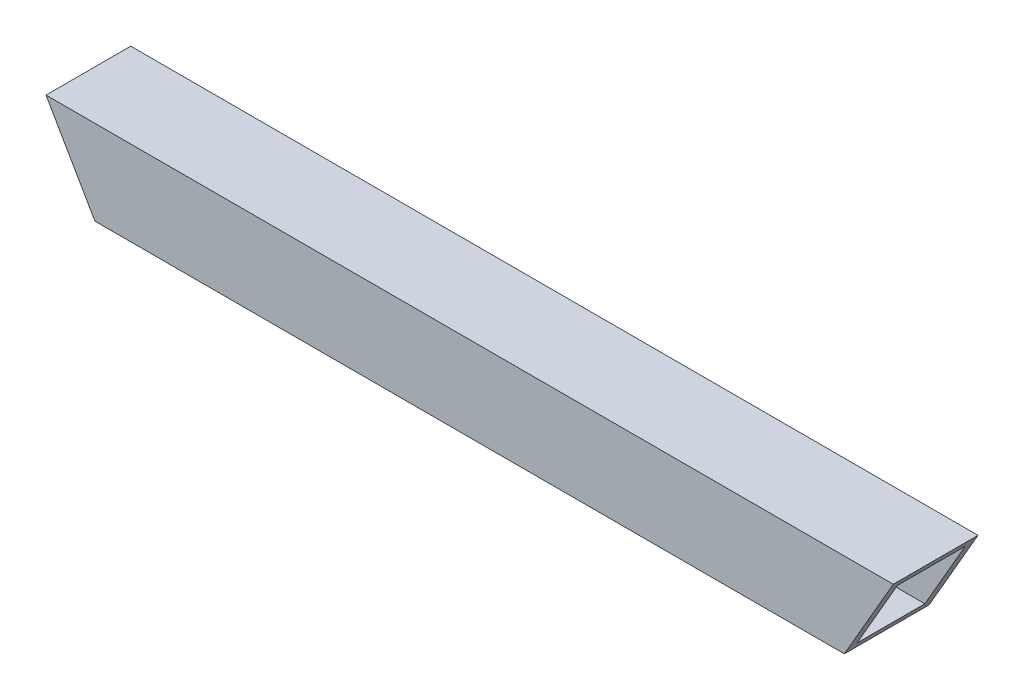
from build123d import *

# Parameters (mm, degrees)
BOSS_EXTRUDE1_DEPTH = 50
SKETCH4_W           = 40
SKETCH4_H           = 47.735026919
CUT_EXTRUDE1_DEPTH  = 584.249890023


with BuildPart() as part:
    # Sketch3 → Boss-Extrude1 (new body)
    with BuildSketch(Plane.XY):
        Polygon((0, 0), (-500, 0), (-471.132486541, -50), (-28.867513459, -50), align=None)
    extrude(amount=BOSS_EXTRUDE1_DEPTH)

    # Sketch4 → Cut-Extrude1 (cut, through all, along a direction that is not the sketch's normal)
    with BuildSketch(Plane(origin=(0, 0, 0), x_dir=(0, 0, -1), z_dir=(0.8660254037844366, -0.5000000000000037, 0))):
        with Locations((-25, -28.86751346)):
            Rectangle(SKETCH4_W, SKETCH4_H)
    extrude(amount=-CUT_EXTRUDE1_DEPTH, dir=(1, 0, 0), mode=Mode.SUBTRACT)


solid = part.part
